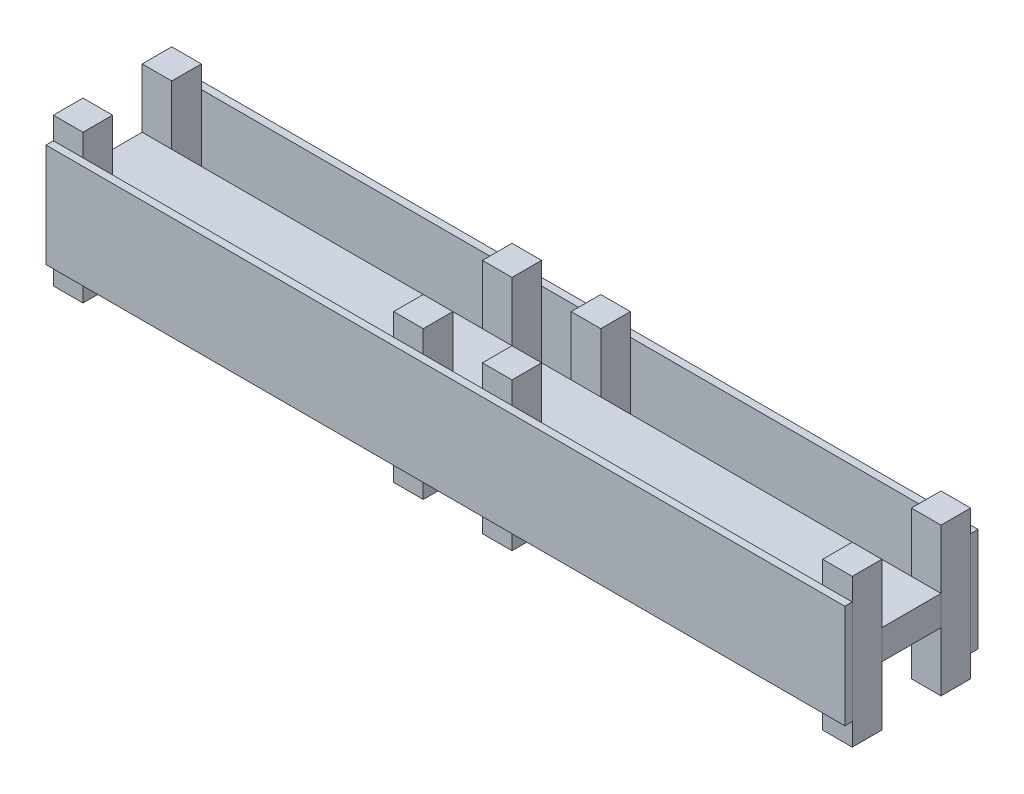
from build123d import *

# Parameters (mm, degrees)
BOSS_EXTRUDE2_DEPTH        = 10
BOSS_EXTRUDE2_DEPTH_BACK   = 10
SKETCH2_W                  = 540
SKETCH2_H                  = 40
BOSS_EXTRUDE3_DEPTH        = 50
BOSS_EXTRUDE3_DEPTH_BACK   = 50
SKETCH3_W                  = 20
SKETCH3_H                  = 20
BOSS_EXTRUDE3_2_DEPTH      = 50
BOSS_EXTRUDE3_2_DEPTH_BACK = 50
BOSS_EXTRUDE3_3_DEPTH      = 50
BOSS_EXTRUDE3_3_DEPTH_BACK = 50
BOSS_EXTRUDE3_4_DEPTH      = 50
BOSS_EXTRUDE3_4_DEPTH_BACK = 50
BOSS_EXTRUDE3_5_DEPTH      = 50
BOSS_EXTRUDE3_5_DEPTH_BACK = 50
BOSS_EXTRUDE3_6_DEPTH      = 50
BOSS_EXTRUDE3_6_DEPTH_BACK = 50
BOSS_EXTRUDE3_7_DEPTH      = 50
BOSS_EXTRUDE3_7_DEPTH_BACK = 50
BOSS_EXTRUDE3_8_DEPTH      = 50
BOSS_EXTRUDE3_8_DEPTH_BACK = 50
SKETCH9_W                  = 540
SKETCH9_H                  = 70
BOSS_EXTRUDE10_DEPTH       = 5
SKETCH10_W                 = 540
SKETCH10_H                 = 70
BOSS_EXTRUDE11_DEPTH       = 5


with BuildPart() as part:
    # Sketch2 → Boss-Extrude2 (new, two sides: drawn at the far end of the back side and taken through both)
    with BuildSketch(Plane(origin=(0, 0, 0), x_dir=(1, 0, 0), z_dir=(0, 1, 0)).offset(-BOSS_EXTRUDE2_DEPTH_BACK)):
        Rectangle(SKETCH2_W, SKETCH2_H)
    extrude(amount=BOSS_EXTRUDE2_DEPTH + BOSS_EXTRUDE2_DEPTH_BACK)


with BuildPart() as body_2:
    # Sketch3 → Boss-Extrude3 (new, two sides: drawn at the far end of the back side and taken through both)
    with BuildSketch(Plane(origin=(0, 0, 0), x_dir=(1, 0, 0), z_dir=(0, 1, 0)).offset(-BOSS_EXTRUDE3_DEPTH_BACK)):
        with Locations((-260, -30)):
            Rectangle(SKETCH3_W, SKETCH3_H)
    extrude(amount=BOSS_EXTRUDE3_DEPTH + BOSS_EXTRUDE3_DEPTH_BACK)


with BuildPart() as body_3:
    # Sketch3 → Boss-Extrude3 2 (new, two sides: drawn at the far end of the back side and taken through both)
    with BuildSketch(Plane(origin=(0, 0, 0), x_dir=(1, 0, 0), z_dir=(0, 1, 0)).offset(-BOSS_EXTRUDE3_2_DEPTH_BACK)):
        with Locations((-30, -30)):
            Rectangle(SKETCH3_W, SKETCH3_H)
    extrude(amount=BOSS_EXTRUDE3_2_DEPTH + BOSS_EXTRUDE3_2_DEPTH_BACK)


with BuildPart() as body_4:
    # Sketch3 → Boss-Extrude3 3 (new, two sides: drawn at the far end of the back side and taken through both)
    with BuildSketch(Plane(origin=(0, 0, 0), x_dir=(1, 0, 0), z_dir=(0, 1, 0)).offset(-BOSS_EXTRUDE3_3_DEPTH_BACK)):
        with Locations((-30, 30)):
            Rectangle(SKETCH3_W, SKETCH3_H)
    extrude(amount=BOSS_EXTRUDE3_3_DEPTH + BOSS_EXTRUDE3_3_DEPTH_BACK)


with BuildPart() as body_5:
    # Sketch3 → Boss-Extrude3 4 (new, two sides: drawn at the far end of the back side and taken through both)
    with BuildSketch(Plane(origin=(0, 0, 0), x_dir=(1, 0, 0), z_dir=(0, 1, 0)).offset(-BOSS_EXTRUDE3_4_DEPTH_BACK)):
        with Locations((-260, 30)):
            Rectangle(SKETCH3_W, SKETCH3_H)
    extrude(amount=BOSS_EXTRUDE3_4_DEPTH + BOSS_EXTRUDE3_4_DEPTH_BACK)


with BuildPart() as body_6:
    # Sketch3 → Boss-Extrude3 5 (new, two sides: drawn at the far end of the back side and taken through both)
    with BuildSketch(Plane(origin=(0, 0, 0), x_dir=(1, 0, 0), z_dir=(0, 1, 0)).offset(-BOSS_EXTRUDE3_5_DEPTH_BACK)):
        with Locations((260, 30)):
            Rectangle(SKETCH3_W, SKETCH3_H)
    extrude(amount=BOSS_EXTRUDE3_5_DEPTH + BOSS_EXTRUDE3_5_DEPTH_BACK)


with BuildPart() as body_7:
    # Sketch3 → Boss-Extrude3 6 (new, two sides: drawn at the far end of the back side and taken through both)
    with BuildSketch(Plane(origin=(0, 0, 0), x_dir=(1, 0, 0), z_dir=(0, 1, 0)).offset(-BOSS_EXTRUDE3_6_DEPTH_BACK)):
        with Locations((30, 30)):
            Rectangle(SKETCH3_W, SKETCH3_H)
    extrude(amount=BOSS_EXTRUDE3_6_DEPTH + BOSS_EXTRUDE3_6_DEPTH_BACK)


with BuildPart() as body_8:
    # Sketch3 → Boss-Extrude3 7 (new, two sides: drawn at the far end of the back side and taken through both)
    with BuildSketch(Plane(origin=(0, 0, 0), x_dir=(1, 0, 0), z_dir=(0, 1, 0)).offset(-BOSS_EXTRUDE3_7_DEPTH_BACK)):
        with Locations((30, -30)):
            Rectangle(SKETCH3_W, SKETCH3_H)
    extrude(amount=BOSS_EXTRUDE3_7_DEPTH + BOSS_EXTRUDE3_7_DEPTH_BACK)


with BuildPart() as body_9:
    # Sketch3 → Boss-Extrude3 8 (new, two sides: drawn at the far end of the back side and taken through both)
    with BuildSketch(Plane(origin=(0, 0, 0), x_dir=(1, 0, 0), z_dir=(0, 1, 0)).offset(-BOSS_EXTRUDE3_8_DEPTH_BACK)):
        with Locations((260, -30)):
            Rectangle(SKETCH3_W, SKETCH3_H)
    extrude(amount=BOSS_EXTRUDE3_8_DEPTH + BOSS_EXTRUDE3_8_DEPTH_BACK)


with BuildPart() as body_10:
    # Sketch9 → Boss-Extrude10 (new body)
    with BuildSketch(Plane.XY.offset(40)):
        Rectangle(SKETCH9_W, SKETCH9_H)
    extrude(amount=BOSS_EXTRUDE10_DEPTH)


with BuildPart() as body_11:
    # Sketch10 → Boss-Extrude11 (new body)
    with BuildSketch(Plane(origin=(0, 0, -40), x_dir=(-1, 0, 0), z_dir=(0, 0, -1))):
        Rectangle(SKETCH10_W, SKETCH10_H)
    extrude(amount=BOSS_EXTRUDE11_DEPTH)


solid = Compound([part.part, body_2.part, body_3.part, body_4.part, body_5.part, body_6.part, body_7.part, body_8.part, body_9.part, body_10.part, body_11.part])
